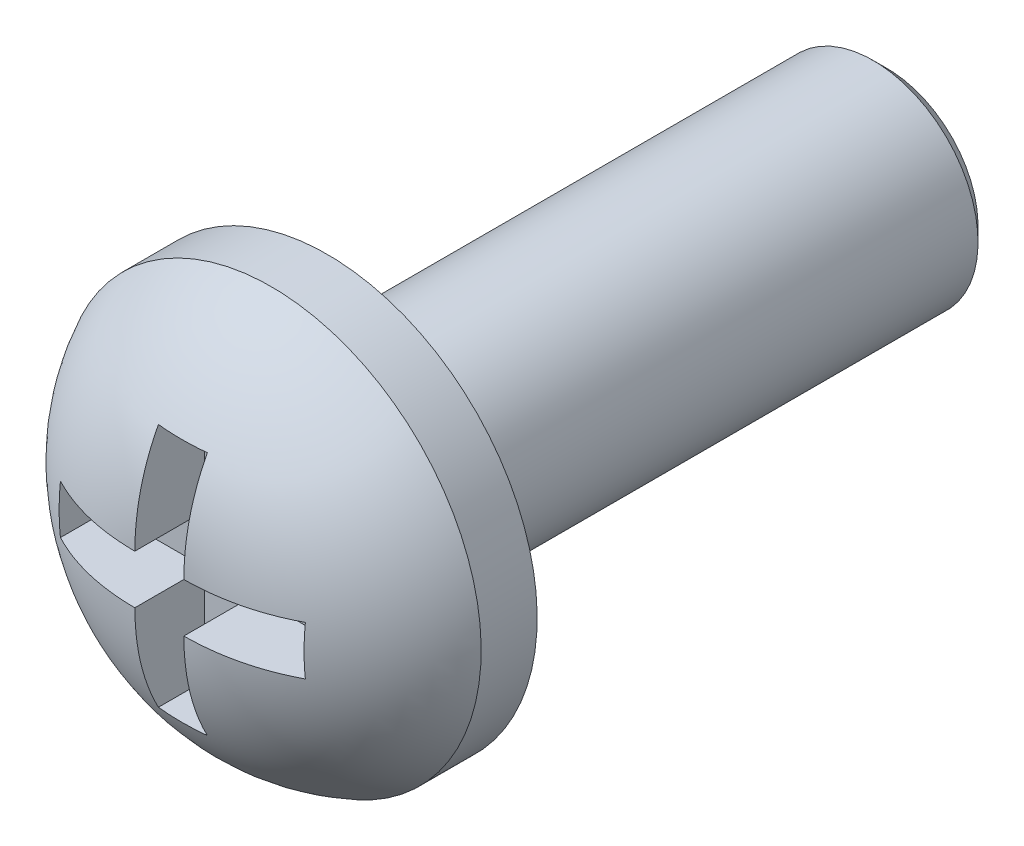
from build123d import *

# Parameters (mm, degrees)
CORTAR_EXTRUIR2_DEPTH = 1
CHAFL_N1_SIZE         = 0.2


with BuildPart() as part:
    # Croquis1 → Revolución1 (revolve)
    with BuildSketch(Plane(origin=(0, 0, 0), x_dir=(0, 0, -1), z_dir=(1, 0, 0)), mode=Mode.PRIVATE) as revoluci_n1_sk:
        with BuildLine():
            Line((0, 3), (0, 1.5))
            Line((0, 1.5), (8, 1.5))
            Line((8, 1.5), (8, 0))
            Line((8, 0), (-2.4, 0))
            Line((-2.4, 0), (-2.4, 0.438750305))
            ThreePointArc((-2.4, 0.438750305), (-1.967126393, 1.948717192), (-0.8, 3))
            Line((-0.8, 3), (0, 3))
        make_face()
    revolve(revoluci_n1_sk.sketch.rotate(Axis((0, 0, -8), (0, 0, -1)), 180), axis=Axis((0, 0, -8), (0, 0, -1)))

    # Croquis2 → Cortar-Extruir2 (cut)
    with BuildSketch(Plane.XY.offset(2.4)):
        Polygon((-0.35, 0.35), (-1.75, 0.35), (-1.75, -0.35), (-0.35, -0.35), (-0.35, -1.75), (0.35, -1.75), (0.35, -0.35), (1.75, -0.35), (1.75, 0.35), (0.35, 0.35), (0.35, 1.75), (-0.35, 1.75), align=None)
    extrude(amount=-CORTAR_EXTRUIR2_DEPTH, mode=Mode.SUBTRACT)

    # Chaflán1
    chafl_n1_edges = [part.edges().sort_by_distance(p)[0] for p in [
        (0, 1.5, -8),
    ]]
    chamfer(chafl_n1_edges, length=CHAFL_N1_SIZE)


solid = part.part
